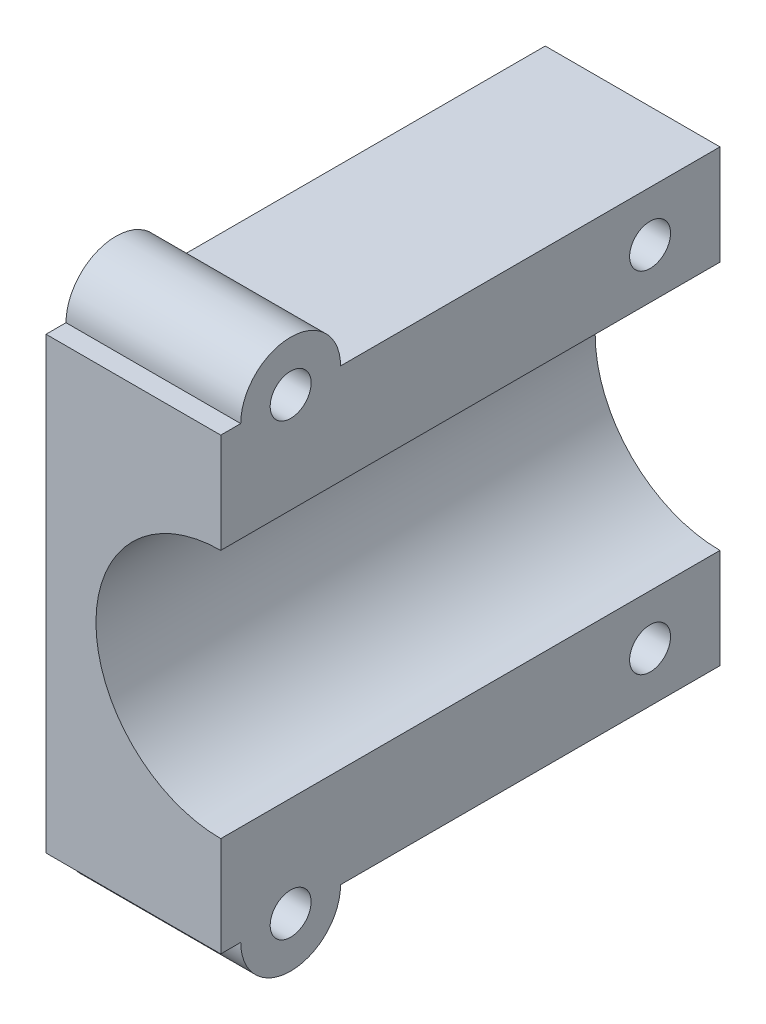
from build123d import *
from build123d.topology import SkipClean

# Parameters (mm, degrees)
BOSS_EXTRUDE1_DEPTH             = 25
BOSS_EXTRUDE2_REACH             = 65.362
BOSS_EXTRUDE2_DIRECTION_2_DEPTH = 30
SKETCH9_R                       = 2.05
CUT_EXTRUDE3_DEPTH              = 35
BOSS_EXTRUDE5_REACH             = 63.601
SKETCH13_R                      = 1.55
CUT_EXTRUDE4_DEPTH              = 88.693844753
SKETCH16_W                      = 63
SKETCH16_H                      = 45
CUT_EXTRUDE5_DEPTH              = 65.196143
BOSS_EXTRUDE6_DEPTH             = 17.5
SKETCH18_R                      = 2.05
CUT_EXTRUDE6_DEPTH              = 17.5
CUT_EXTRUDE7_START              = -7.35
CUT_EXTRUDE7_DEPTH              = 3.3


with BuildPart() as part:
    # Sketch1 → Boss-Extrude1 (new, symmetric)
    with BuildSketch(Plane.XY):
        with BuildLine():
            Line((-17.5, 22.5), (-17.5, 0))
            Line((-17.5, 0), (17.5, 0))
            Line((17.5, 0), (17.5, 22.5))
            Line((17.5, 22.5), (12.5, 22.5))
            ThreePointArc((12.5, 22.5), (0, 10), (-12.5, 22.5))
            Line((-12.5, 22.5), (-17.5, 22.5))
        make_face()
    boss_extrude1 = extrude(amount=BOSS_EXTRUDE1_DEPTH, both=True)

    # Boss-Extrude2: up to this face of the body (flat: up to its plane)
    boss_extrude2_end = Plane(part.part.faces().sort_by_distance((17.5, 11.25, 0))[0])
    # Sketch5 → Boss-Extrude2 (add, up to the picked face)
    with BuildSketch(Plane(origin=(26.115381057, 0, 15.077722283), x_dir=(0.500000000000001, 0, -0.8660254037844382), z_dir=(0.8660254037844382, 0, 0.500000000000001)), mode=Mode.PRIVATE) as boss_extrude2_sk1:
        with BuildLine():
            Line((-8.7, 22.5), (-3.75, 22.5))
            ThreePointArc((-3.75, 22.5), (8.75, 10), (21.25, 22.5))
            Line((21.25, 22.5), (26.2, 22.5))
            ThreePointArc((26.2, 22.5), (8.75, 5.05), (-8.7, 22.5))
        make_face()
    boss_extrude2_tool1 = split(extrude(boss_extrude2_sk1.sketch, amount=-BOSS_EXTRUDE2_REACH, mode=Mode.PRIVATE), bisect_by=boss_extrude2_end, keep=Keep.BOTH, mode=Mode.PRIVATE)
    boss_extrude2 = boss_extrude2_tool1.solids().sort_by(Axis((23.002881, 22.109806, 20.46873), (-0.8660254037844382, 0, -0.500000000000001)))[0]
    add(boss_extrude2)

    # Sketch5 → Boss-Extrude2 direction 2 (add)
    with BuildSketch(Plane(origin=(26.115381057, 0, 15.077722283), x_dir=(0.500000000000001, 0, -0.8660254037844382), z_dir=(0.8660254037844382, 0, 0.500000000000001))):
        with BuildLine():
            Line((-8.7, 22.5), (-3.75, 22.5))
            ThreePointArc((-3.75, 22.5), (8.75, 10), (21.25, 22.5))
            Line((21.25, 22.5), (26.2, 22.5))
            ThreePointArc((26.2, 22.5), (8.75, 5.05), (-8.7, 22.5))
        make_face()
    boss_extrude2_direction_2 = extrude(amount=BOSS_EXTRUDE2_DIRECTION_2_DEPTH)

    # Sketch9 → Cut-Extrude3 (cut)
    with BuildSketch(Plane.ZY.offset(17.5)):
        with Locations((-18, 5)):
            Circle(SKETCH9_R)
    cut_extrude3 = extrude(amount=-CUT_EXTRUDE3_DEPTH, mode=Mode.SUBTRACT)

    # Boss-Extrude5: up to this face of the body (flat: up to its plane)
    boss_extrude5_end = Plane(part.part.faces().sort_by_distance((17.5, 17.19483523, 0))[0])
    # Sketch12 → Boss-Extrude5 (add, up to the picked face)
    with BuildSketch(Plane(origin=(21.973076211, 0, 12.686161466), x_dir=(0.4999999999999999, 0, -0.8660254037844388), z_dir=(0.8660254037844388, 0, 0.4999999999999999)), mode=Mode.PRIVATE) as boss_extrude5_sk1:
        with BuildLine():
            Line((-3.75, 22.5), (21.25, 22.5))
            ThreePointArc((21.25, 22.5), (8.75, 10), (-3.75, 22.5))
        make_face()
    boss_extrude5_tool1 = split(extrude(boss_extrude5_sk1.sketch, amount=-BOSS_EXTRUDE5_REACH, mode=Mode.PRIVATE), bisect_by=boss_extrude5_end, keep=Keep.BOTH, mode=Mode.PRIVATE)
    boss_extrude5 = boss_extrude5_tool1.solids().sort_by(Axis((26.348076, 17.194835, 5.108439), (-0.8660254037844388, 0, -0.4999999999999999)))[0]
    add(boss_extrude5)

    # Mirror1: Boss-Extrude1, Boss-Extrude2, Boss-Extrude2 direction 2, Cut-Extrude3, Boss-Extrude5 across plane
    with SkipClean():  # the faces are left unmerged after this step: merging them gives an invalid solid
        add(boss_extrude1.mirror(Plane(origin=(17.5, 22.5, 25), x_dir=(0, 0, 1), z_dir=(0, -1, 0))))
        add(boss_extrude2.mirror(Plane(origin=(17.5, 22.5, 25), x_dir=(0, 0, 1), z_dir=(0, -1, 0))))
        add(boss_extrude2_direction_2.mirror(Plane(origin=(17.5, 22.5, 25), x_dir=(0, 0, 1), z_dir=(0, -1, 0))))
        add(cut_extrude3.mirror(Plane(origin=(17.5, 22.5, 25), x_dir=(0, 0, 1), z_dir=(0, -1, 0))), mode=Mode.SUBTRACT)
        add(boss_extrude5.mirror(Plane(origin=(17.5, 22.5, 25), x_dir=(0, 0, 1), z_dir=(0, -1, 0))))

    # Sketch13 → Cut-Extrude4 (cut, through all)
    with SkipClean():  # the faces are left unmerged after this step: merging them gives an invalid solid
        with BuildSketch(Plane(origin=(0, 0, 0), x_dir=(1, 0, 0), z_dir=(0, 1, 0))):
            with Locations(Location((43.480762114, -15, 0), (0, 0, 90))):
                Circle(SKETCH13_R)
        extrude(amount=CUT_EXTRUDE4_DEPTH, mode=Mode.SUBTRACT)

    # Sketch16 → Cut-Extrude5 (cut)
    with BuildSketch(Plane(origin=(0, 0, 0), x_dir=(0, 0, -1), z_dir=(1, 0, 0))):
        with Locations((-6.5, 22.5)):
            Rectangle(SKETCH16_W, SKETCH16_H)
    extrude(amount=CUT_EXTRUDE5_DEPTH, mode=Mode.SUBTRACT)

    # Sketch17 → Boss-Extrude6 (add)
    with BuildSketch(Plane.ZY.offset(17.5)):
        with BuildLine():
            Line((13, 0), (23, 0))
            ThreePointArc((23, 0), (18, -5), (13, 0))
        make_face()
    boss_extrude6 = extrude(amount=-BOSS_EXTRUDE6_DEPTH)

    # Sketch18 → Cut-Extrude6 (cut)
    with BuildSketch(Plane.ZY.offset(17.5)):
        with Locations(Location((18, 0, 0), (0, 0, 270))):
            Circle(SKETCH18_R)
    cut_extrude6 = extrude(amount=-CUT_EXTRUDE6_DEPTH, mode=Mode.SUBTRACT)

    # Mirror2: Boss-Extrude6, Cut-Extrude6 across plane
    add(boss_extrude6.mirror(Plane.ZX.offset(22.5)))
    add(cut_extrude6.mirror(Plane.ZX.offset(22.5)), mode=Mode.SUBTRACT)

    # Sketch20 → Cut-Extrude7 (cut)
    with BuildSketch(Plane(origin=(0, 0, 0), x_dir=(0, 0, -1), z_dir=(1, 0, 0)).offset(CUT_EXTRUDE7_START)):
        Polygon((22.156921938, 40), (20.078460969, 43.6), (15.921539031, 43.6), (13.843078062, 40), (15.921539031, 36.4), (20.078460969, 36.4), align=None)
        Polygon((-13.843078062, 0), (-15.921539031, 3.6), (-20.078460969, 3.6), (-22.156921938, 0), (-20.078460969, -3.6), (-15.921539031, -3.6), align=None)
    extrude(amount=-CUT_EXTRUDE7_DEPTH, mode=Mode.SUBTRACT)


solid = part.part
